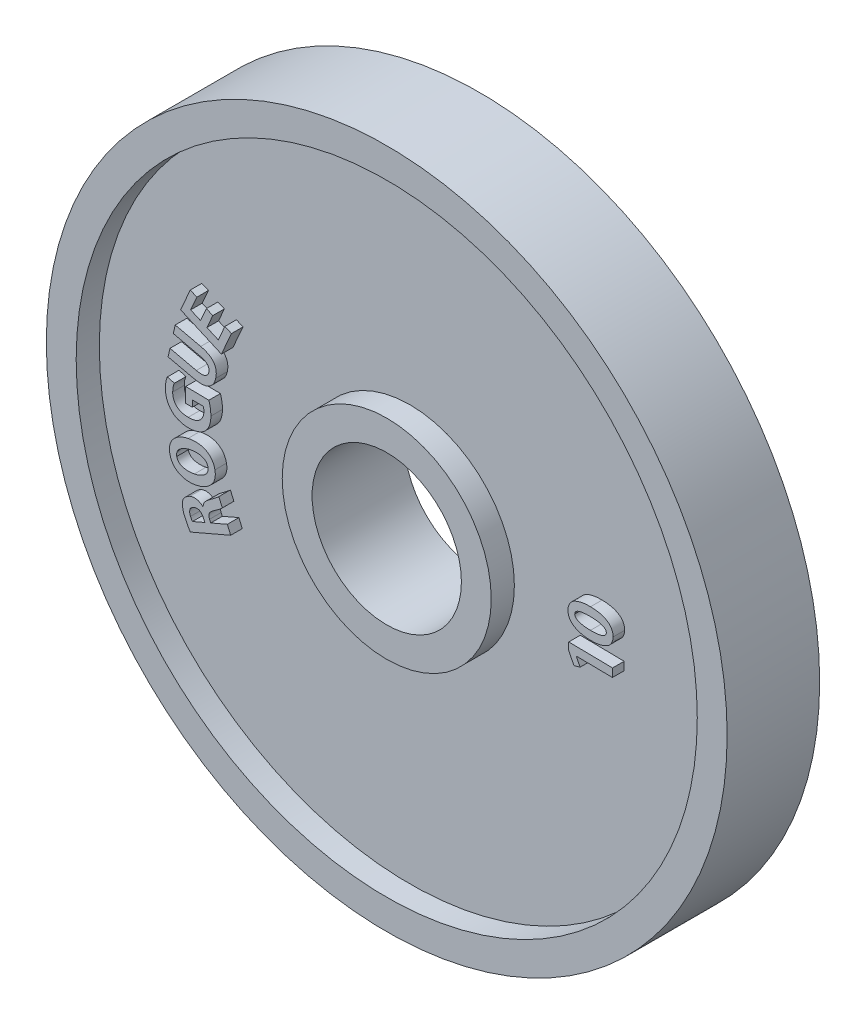
from build123d import *

# Parameters (mm, degrees)
SKETCH1_R           = 114
SKETCH1_R_2         = 25
BOSS_EXTRUDE1_DEPTH = 15.494
SKETCH2_R           = 104
SKETCH2_R_2         = 35
CUT_EXTRUDE1_DEPTH  = 7.747
BOSS_EXTRUDE2_DEPTH = 3.8735
BOSS_EXTRUDE3_DEPTH = 3.8735


with BuildPart() as part:
    # Sketch1 → Boss-Extrude1 (new, symmetric)
    with BuildSketch(Plane.XY):
        Circle(SKETCH1_R)
        Circle(SKETCH1_R_2, mode=Mode.SUBTRACT)
    extrude(amount=BOSS_EXTRUDE1_DEPTH, both=True)

    # Sketch2 → Cut-Extrude1 (cut)
    with BuildSketch(Plane.XY.offset(15.494)):
        Circle(SKETCH2_R)
        Circle(SKETCH2_R_2, mode=Mode.SUBTRACT)
    cut_extrude1 = extrude(amount=-CUT_EXTRUDE1_DEPTH, mode=Mode.SUBTRACT)

    # Sketch3 → Boss-Extrude2 (add)
    # profile 1 of 5: a face of its own
    with BuildSketch(Plane.XY.offset(7.747)):
        Polygon((-60.286471184, 25.582132055), (-64.087560951, 27.25839268), (-62.121479564, 31.716680211), (-64.270693872, 32.664472433), (-66.236775259, 28.206184903), (-69.540526178, 29.663121707), (-67.456949887, 34.387840764), (-69.6594505, 35.359131967), (-72.902309839, 28.005621857), (-59.24325362, 21.982049798), (-55.875066383, 29.619753536), (-58.077566996, 30.591044739), align=None)
    # profile 2 of 5: a face of its own
    with BuildSketch(Plane.XY.offset(7.747)):
        with BuildLine():
            Line((-75.346816467, 19.897241959), (-66.547785694, 17.881515031))
            add(Edge.make_bspline(
                [(-66.547785694, 17.881515031), (-66.393512184, 17.843386183), (-66.094568138, 17.769501872), (-65.668729211, 17.637308629), (-65.27849277, 17.495206858), (-64.926919007, 17.337505331), (-64.611067758, 17.170555263), (-64.333897809, 16.989729925), (-64.091997129, 16.799801126), (-63.890631002, 16.592383232), (-63.724798443, 16.373750598), (-63.583581558, 16.149036188), (-63.481141954, 15.91150908), (-63.404764195, 15.667002332), (-63.36794847, 15.411314117), (-63.355086408, 15.147557795), (-63.378658591, 14.873955514), (-63.417145205, 14.692346183), (-63.436918469, 14.599040772)],
                knots=[0, 0, 0, 0, 1.48875779, 2.884845742, 4.175826487, 5.37772822, 6.492655506, 7.519728366, 8.474900886, 9.368474524, 10.21968269, 11.042885758, 11.848312276, 12.63668492, 13.435921479, 14.261506249, 15.106814207, 16, 16, 16, 16], degree=3))
            add(Edge.make_bspline(
                [(-63.436918469, 14.599040772), (-63.45916645, 14.51035801), (-63.502806259, 14.336405198), (-63.602610084, 14.091752292), (-63.72394754, 13.866699535), (-63.871128536, 13.661624907), (-64.047037709, 13.479649027), (-64.244098251, 13.315357816), (-64.46701121, 13.173291722), (-64.714979915, 13.05312991), (-64.989232959, 12.953376035), (-65.291209982, 12.884436109), (-65.620563428, 12.84358389), (-65.976568542, 12.826802591), (-66.359481284, 12.840035657), (-66.769395212, 12.877022146), (-67.206594505, 12.94136874), (-67.505315637, 13.004430843), (-67.659524804, 13.036985468)],
                knots=[0, 0, 0, 0, 0.86400193, 1.694755128, 2.491561966, 3.278358146, 4.074130137, 4.879460264, 5.700234368, 6.567907229, 7.481446286, 8.454875503, 9.491061486, 10.617394065, 11.822722667, 13.112412442, 14.509337228, 16, 16, 16, 16], degree=3))
            Line((-67.659524804, 13.036985468), (-76.456550001, 15.053044372))
            Line((-76.456550001, 15.053044372), (-77.098114701, 12.252492642))
            Line((-77.098114701, 12.252492642), (-68.545078337, 10.293119371))
            add(Edge.make_bspline(
                [(-68.545078337, 10.293119371), (-68.287083188, 10.237575442), (-67.786999579, 10.129912144), (-67.05017072, 10.034403218), (-66.3559383, 9.983098329), (-65.704527146, 9.986784176), (-65.095410294, 10.046154035), (-64.528117011, 10.151861864), (-64.004655039, 10.319643829), (-63.522831932, 10.535819384), (-63.083930697, 10.805382874), (-62.685685054, 11.122168259), (-62.325558685, 11.484551249), (-62.006899488, 11.89544841), (-61.727829491, 12.352452023), (-61.493078964, 12.857820707), (-61.29069566, 13.40584366), (-61.195842468, 13.793475892), (-61.147215101, 13.992199143)],
                knots=[0, 0, 0, 0, 1.339526843, 2.59646517, 3.769042117, 4.872296921, 5.89953709, 6.873164299, 7.7965368, 8.683983356, 9.548468306, 10.404740217, 11.262173283, 12.13633444, 13.03913999, 13.975087544, 14.961909886, 16, 16, 16, 16], degree=3))
            add(Edge.make_bspline(
                [(-61.147215101, 13.992199143), (-61.104291173, 14.195725897), (-61.020735265, 14.591911972), (-60.958135198, 15.182805746), (-60.955655707, 15.75015863), (-61.00445691, 16.295588644), (-61.111703995, 16.818675894), (-61.274699861, 17.3187575), (-61.496468048, 17.794378719), (-61.772436477, 18.246430958), (-62.109243222, 18.67098421), (-62.509154354, 19.062006638), (-62.968173399, 19.424485296), (-63.490725734, 19.751237718), (-64.073294128, 20.050305826), (-64.717473053, 20.315208793), (-65.423109694, 20.548733996), (-65.917745105, 20.675171946), (-66.173324703, 20.740502813)],
                knots=[0, 0, 0, 0, 1.040329616, 2.02511021, 2.967003703, 3.875322497, 4.760327715, 5.633140889, 6.501097599, 7.380315193, 8.277542573, 9.205342804, 10.17283583, 11.198562336, 12.284173383, 13.445937183, 14.680308094, 16, 16, 16, 16], degree=3))
            Line((-66.173324703, 20.740502813), (-74.705251767, 22.697793689))
            Line((-74.705251767, 22.697793689), (-75.346816467, 19.897241959))
        make_face()
    # profile 3 of 5: a face of its own
    with BuildSketch(Plane.XY.offset(7.747)):
        with BuildLine():
            Line((-71.257173175, 1.728642416), (-68.986085169, 1.696863234))
            Line((-68.986085169, 1.696863234), (-68.955935689, 3.851485188))
            Line((-68.955935689, 3.851485188), (-65.306666073, 3.800421204))
            add(Edge.make_bspline(
                [(-65.306666073, 3.800421204), (-65.291474755, 3.76277559), (-65.25917644, 3.682737121), (-65.224883338, 3.548765811), (-65.190197834, 3.396418936), (-65.162000909, 3.221975114), (-65.144994587, 3.025646415), (-65.125925828, 2.809510907), (-65.11984809, 2.572276609), (-65.116399537, 2.407434246), (-65.11459723, 2.321283143)],
                knots=[0, 0, 0, 0, 0.648936774, 1.379706706, 2.208670299, 3.149786387, 4.204011777, 5.361402424, 6.620997133, 8, 8, 8, 8], degree=3))
            add(Edge.make_bspline(
                [(-65.11459723, 2.321283143), (-65.120968475, 2.16743663), (-65.133460108, 1.865801071), (-65.202774641, 1.425564758), (-65.307893959, 1.006679628), (-65.459374959, 0.611138197), (-65.646088515, 0.235173834), (-65.880559449, -0.114913988), (-66.15000171, -0.444861863), (-66.46115932, -0.749871623), (-66.811106727, -1.02547806), (-67.204479728, -1.262807838), (-67.635697698, -1.465178674), (-68.107549215, -1.630086907), (-68.618752039, -1.760236599), (-69.170097825, -1.846129773), (-69.760176985, -1.904805512), (-70.166773235, -1.911773069), (-70.376700799, -1.915370451)],
                knots=[0, 0, 0, 0, 0.968728953, 1.89931571, 2.800217423, 3.68281719, 4.560856096, 5.437349611, 6.329663634, 7.238555762, 8.175044564, 9.127561758, 10.124532544, 11.168795398, 12.269883655, 13.440786937, 14.678666205, 16, 16, 16, 16], degree=3))
            add(Edge.make_bspline(
                [(-70.376700799, -1.915370451), (-70.594230559, -1.905497325), (-71.015611734, -1.886371897), (-71.623727142, -1.805599545), (-72.188715711, -1.694032575), (-72.707403362, -1.535701627), (-73.182109473, -1.342270829), (-73.614170833, -1.112345354), (-73.998161901, -0.837946654), (-74.337025718, -0.526884256), (-74.632520826, -0.184892344), (-74.888501253, 0.180427123), (-75.104297844, 0.567927775), (-75.275694156, 0.978331185), (-75.40847265, 1.411166737), (-75.500552428, 1.866484306), (-75.551930157, 2.344413435), (-75.553645576, 2.669532297), (-75.554520809, 2.835412857)],
                knots=[0, 0, 0, 0, 1.311203904, 2.539958864, 3.691718909, 4.77676166, 5.801354197, 6.77568181, 7.718078945, 8.636445122, 9.540244502, 10.435463789, 11.319305436, 12.206758612, 13.109712463, 14.042400903, 15.001203341, 16, 16, 16, 16], degree=3))
            add(Edge.make_bspline(
                [(-75.554520809, 2.835412857), (-75.549342503, 2.992813475), (-75.539373976, 3.295818435), (-75.502984931, 3.730864702), (-75.450355735, 4.129552548), (-75.38028165, 4.492461973), (-75.295216168, 4.826327086), (-75.196200829, 5.131791536), (-75.094197017, 5.41798683), (-75.010892545, 5.594882018), (-74.970154796, 5.681387719)],
                knots=[0, 0, 0, 0, 1.290633007, 2.484540449, 3.576592985, 4.585178413, 5.512284822, 6.398318909, 7.216742151, 8, 8, 8, 8], degree=3))
            Line((-74.970154796, 5.681387719), (-77.32803676, 6.317827363))
            add(Edge.make_bspline(
                [(-77.32803676, 6.317827363), (-77.374445246, 6.219712107), (-77.47192755, 6.013618306), (-77.590345278, 5.672674533), (-77.699396222, 5.289887264), (-77.796876286, 4.865252421), (-77.877996691, 4.402089544), (-77.938409064, 3.905984643), (-77.98136481, 3.378297215), (-77.992836665, 3.016235652), (-77.998744037, 2.829793953)],
                knots=[0, 0, 0, 0, 0.72766899, 1.528488784, 2.41732343, 3.397227608, 4.449702492, 5.570233277, 6.748804397, 8, 8, 8, 8], degree=3))
            add(Edge.make_bspline(
                [(-77.998744037, 2.829793953), (-77.99554144, 2.560825971), (-77.989265428, 2.03373924), (-77.907133912, 1.259769981), (-77.761716486, 0.521492286), (-77.552728831, -0.180715681), (-77.286121922, -0.84938392), (-76.951307011, -1.479884492), (-76.560859974, -2.080059412), (-76.180055991, -2.543684449), (-75.851018638, -2.895621603), (-75.58307807, -3.139554661), (-75.307555274, -3.375259194), (-75.010216528, -3.586063775), (-74.704078943, -3.788595723), (-74.379678542, -3.969536048), (-74.042936722, -4.138990189), (-73.691096093, -4.29084603), (-73.324651131, -4.424501838), (-72.945265083, -4.548087928), (-72.548709904, -4.644846295), (-72.14060752, -4.738920795), (-71.715940865, -4.805919488), (-71.277700163, -4.863480313), (-70.824853221, -4.902161587), (-70.518165754, -4.916846991), (-70.362653539, -4.924293528)],
                knots=[0, 0, 0, 0, 1.577349294, 3.0910738, 4.558540398, 5.985643026, 7.383297865, 8.774231271, 10.166953729, 11.57669276, 12.287866084, 12.991530258, 13.701280405, 14.413386805, 15.128052883, 15.85378282, 16.590861035, 17.338933897, 18.100264297, 18.878648983, 19.678132549, 20.493910141, 21.334775367, 22.198831703, 23.086680412, 24, 24, 24, 24], degree=3))
            add(Edge.make_bspline(
                [(-70.362653539, -4.924293528), (-70.070207503, -4.921978516), (-69.497856134, -4.917447763), (-68.660907613, -4.823337826), (-67.863771652, -4.674720932), (-67.111209896, -4.455755419), (-66.409267187, -4.176008717), (-65.763156946, -3.840487289), (-65.176076578, -3.449864267), (-64.833861524, -3.139057872), (-64.665084912, -2.985771658)],
                knots=[0, 0, 0, 0, 1.136680665, 2.224618065, 3.270325393, 4.286883451, 5.267524713, 6.204201311, 7.114332304, 8, 8, 8, 8], degree=3))
            add(Edge.make_bspline(
                [(-64.665084912, -2.985771658), (-64.515064056, -2.827087286), (-64.214565499, -2.509235314), (-63.832864293, -1.969700587), (-63.50758448, -1.383513411), (-63.241015097, -0.749323618), (-63.03312519, -0.066574304), (-62.882808346, 0.662190216), (-62.78910238, 1.439543571), (-62.773777192, 1.97357981), (-62.765895369, 2.248237392)],
                knots=[0, 0, 0, 0, 0.915959266, 1.834707821, 2.765809318, 3.726141495, 4.717425164, 5.757718867, 6.84678329, 8, 8, 8, 8], degree=3))
            add(Edge.make_bspline(
                [(-62.765895369, 2.248237392), (-62.767572913, 2.460882861), (-62.770879305, 2.880001261), (-62.81142173, 3.49878559), (-62.877840194, 4.098987127), (-62.973825783, 4.67284669), (-63.083554403, 5.2088851), (-63.192789605, 5.69548548), (-63.3131575, 6.123711781), (-63.403482025, 6.386913561), (-63.44578275, 6.510176054)],
                knots=[0, 0, 0, 0, 1.176979382, 2.319794152, 3.431000493, 4.518493807, 5.539253432, 6.459768033, 7.278679526, 8, 8, 8, 8], degree=3))
            Line((-63.44578275, 6.510176054), (-71.188725706, 6.620216582))
            Line((-71.188725706, 6.620216582), (-71.257173175, 1.728642416))
        make_face()
    # profile 4 of 5: a face of its own
    with BuildSketch(Plane.XY.offset(7.747)):
        with BuildLine():
            add(Edge.make_bspline(
                [(-76.507706854, -15.564679114), (-76.448641989, -15.798915705), (-76.333360683, -16.256092738), (-76.082903922, -16.903333886), (-75.778953324, -17.498429094), (-75.416904551, -18.040617582), (-75.0025115, -18.533967328), (-74.528490507, -18.971897177), (-74.000764129, -19.358622746), (-73.420197439, -19.687774992), (-72.801012293, -19.966815858), (-72.146448415, -20.180898252), (-71.465449832, -20.343193222), (-70.754434659, -20.44316665), (-70.014888847, -20.484592113), (-69.24677376, -20.465806977), (-68.450268223, -20.39130005), (-67.914264284, -20.295665048), (-67.640442614, -20.246809183)],
                knots=[0, 0, 0, 0, 1.030942932, 2.012168244, 2.956667389, 3.879613322, 4.790670262, 5.701981774, 6.62916456, 7.578697646, 8.54726315, 9.524960566, 10.515475647, 11.533626462, 12.587250259, 13.675426278, 14.812473914, 16, 16, 16, 16], degree=3))
            add(Edge.make_bspline(
                [(-67.640442614, -20.246809183), (-67.376306876, -20.186884789), (-66.859337501, -20.069600106), (-66.116534621, -19.83389787), (-65.419583213, -19.561783701), (-64.767793804, -19.249808007), (-64.161835477, -18.896973933), (-63.605855819, -18.497912724), (-63.095245994, -18.061046939), (-62.630995234, -17.588262224), (-62.224327234, -17.078790901), (-61.89105933, -16.532502498), (-61.627588899, -15.958295377), (-61.434498775, -15.354907428), (-61.316735013, -14.7215635), (-61.274261707, -14.059103672), (-61.297910069, -13.367745718), (-61.369574231, -12.902380625), (-61.406268657, -12.664098273)],
                knots=[0, 0, 0, 0, 1.178993051, 2.307538178, 3.389691794, 4.434821654, 5.45106185, 6.438998567, 7.410778017, 8.373962956, 9.320374973, 10.242877386, 11.15344982, 12.065254194, 12.994644299, 13.951124069, 14.950907616, 16, 16, 16, 16], degree=3))
            add(Edge.make_bspline(
                [(-61.406268657, -12.664098273), (-61.459174207, -12.439110068), (-61.562620751, -11.999189261), (-61.786427521, -11.370550712), (-62.065310566, -10.790181365), (-62.39531613, -10.253257099), (-62.783272843, -9.765202147), (-63.223291984, -9.321107436), (-63.719705269, -8.92669859), (-64.264842502, -8.576650424), (-64.863164987, -8.284049677), (-65.510363751, -8.052789095), (-66.206864117, -7.888498157), (-66.950787894, -7.785239945), (-67.743242745, -7.747808534), (-68.582676148, -7.775364212), (-69.470568549, -7.865780418), (-70.073998733, -7.971274233), (-70.385277204, -8.025693044)],
                knots=[0, 0, 0, 0, 0.971616526, 1.899807702, 2.800097369, 3.675686937, 4.544944974, 5.416760719, 6.299542019, 7.206485548, 8.136638855, 9.094771387, 10.091261422, 11.141338146, 12.249588338, 13.423964941, 14.671156539, 16, 16, 16, 16], degree=3))
            add(Edge.make_bspline(
                [(-70.385277204, -8.025693044), (-70.631508984, -8.080316875), (-71.116105415, -8.187819299), (-71.816530934, -8.405501151), (-72.478811917, -8.664897135), (-73.104953024, -8.961443768), (-73.690985427, -9.303566229), (-74.241720147, -9.683394621), (-74.754480933, -10.105751967), (-75.148794596, -10.492466835), (-75.439969349, -10.819836461), (-75.641807089, -11.073601954), (-75.820873983, -11.338750252), (-75.984146068, -11.611639158), (-76.131721386, -11.893063716), (-76.257062682, -12.184676752), (-76.364190495, -12.484228906), (-76.454478128, -12.791855331), (-76.527711508, -13.108759422), (-76.58093184, -13.434436249), (-76.613888593, -13.768506563), (-76.631630402, -14.110760197), (-76.627377073, -14.462411908), (-76.608350986, -14.823439309), (-76.568846191, -15.192785915), (-76.529670676, -15.440923928), (-76.509882533, -15.566262174)],
                knots=[0, 0, 0, 0, 1.663556076, 3.273961384, 4.833286237, 6.353322139, 7.840155918, 9.305587846, 10.762842645, 12.217803286, 12.944384344, 13.652686548, 14.355333609, 15.053647759, 15.750073201, 16.450243702, 17.146011, 17.847924169, 18.564372358, 19.290664366, 20.023523602, 20.778248709, 21.550623865, 22.342692496, 23.162869027, 24, 24, 24, 24], degree=3))
            Line((-76.509882533, -15.566262174), (-76.507706854, -15.564679114))
        make_face()
        with BuildLine():
            add(Edge.make_bspline(
                [(-74.190830817, -15.168351588), (-74.208200397, -15.036186723), (-74.242078535, -14.778408488), (-74.227392573, -14.394396667), (-74.172086322, -14.026331987), (-74.054911042, -13.676923511), (-73.896207261, -13.341437725), (-73.676590515, -13.028800352), (-73.415442062, -12.728176984), (-73.100683934, -12.453912658), (-72.753959963, -12.194579993), (-72.380963063, -11.953865076), (-71.984964546, -11.733266084), (-71.565910061, -11.53476857), (-71.124656734, -11.354080861), (-70.658730267, -11.197690673), (-70.171526229, -11.058942845), (-69.836017782, -10.986852001), (-69.666057495, -10.950332562)],
                knots=[0, 0, 0, 0, 0.930930736, 1.815714643, 2.678395105, 3.525715937, 4.384207394, 5.265492005, 6.189287182, 7.163659837, 8.179077214, 9.216653281, 10.266544308, 11.34780991, 12.458502948, 13.599989841, 14.784214179, 16, 16, 16, 16], degree=3))
            add(Edge.make_bspline(
                [(-69.666057495, -10.950332562), (-69.480967718, -10.914601948), (-69.118713324, -10.844670632), (-68.580104801, -10.775889878), (-68.061741019, -10.732054072), (-67.561657468, -10.720460786), (-67.081069481, -10.739207466), (-66.619439858, -10.790357487), (-66.176760959, -10.867768253), (-65.756561373, -10.976810133), (-65.363812084, -11.113347754), (-65.00843316, -11.289535457), (-64.692301953, -11.496937637), (-64.414399652, -11.738404675), (-64.180869009, -12.0164963), (-63.984201092, -12.325453783), (-63.831271984, -12.669893844), (-63.762239877, -12.915000965), (-63.726875997, -13.040564839)],
                knots=[0, 0, 0, 0, 1.294378985, 2.533335351, 3.72712705, 4.865850014, 5.966612518, 7.027765508, 8.053494751, 9.050343993, 10.006502908, 10.903943613, 11.767342203, 12.596872572, 13.422879655, 14.252609478, 15.104843948, 16, 16, 16, 16], degree=3))
            add(Edge.make_bspline(
                [(-63.726875997, -13.040564839), (-63.709273245, -13.168595666), (-63.674678887, -13.420212252), (-63.684420149, -13.79598358), (-63.743680001, -14.157018898), (-63.852416045, -14.503588254), (-64.006984328, -14.837526984), (-64.21589737, -15.154859411), (-64.474061128, -15.456136611), (-64.778379669, -15.740787533), (-65.119427027, -16.008554677), (-65.493298864, -16.255021147), (-65.890762324, -16.487529889), (-66.321500188, -16.690247871), (-66.775230458, -16.879690828), (-67.258956506, -17.044867894), (-67.769944506, -17.1915645), (-68.123217203, -17.270602839), (-68.303473282, -17.310931858)],
                knots=[0, 0, 0, 0, 0.892961903, 1.754921301, 2.58895955, 3.416884956, 4.260407616, 5.126618111, 6.036716313, 6.999228421, 8.005078455, 9.032974195, 10.095413095, 11.18794985, 12.32381609, 13.495862028, 14.722272913, 16, 16, 16, 16], degree=3))
            add(Edge.make_bspline(
                [(-68.303473282, -17.310931858), (-68.474588646, -17.343317023), (-68.811896378, -17.407155632), (-69.315188057, -17.476023272), (-69.806889538, -17.510686799), (-70.286116036, -17.52458237), (-70.753476417, -17.504150061), (-71.208279666, -17.45593425), (-71.651926637, -17.384378948), (-72.078361594, -17.280747787), (-72.482915948, -17.151900998), (-72.848060236, -16.974013469), (-73.177376516, -16.76759421), (-73.464760688, -16.52074828), (-73.708502731, -16.234997358), (-73.915423969, -15.91573321), (-74.080298239, -15.557722124), (-74.154208597, -15.3014556), (-74.192084645, -15.170129444)],
                knots=[0, 0, 0, 0, 1.202398014, 2.370202993, 3.504903811, 4.60445999, 5.678801092, 6.732075408, 7.761093576, 8.778938089, 9.760436391, 10.685914818, 11.575620908, 12.437590667, 13.290441376, 14.160329912, 15.057244007, 16, 16, 16, 16], degree=3))
            Line((-74.192084645, -15.170129444), (-74.190830817, -15.168351588))
        make_face(mode=Mode.SUBTRACT)
    # profile 5 of 5: a face of its own
    with BuildSketch(Plane.XY.offset(7.747)):
        with BuildLine():
            Line((-56.123841132, -29.003529012), (-57.252705827, -26.38241731))
            Line((-57.252705827, -26.38241731), (-62.815881685, -28.77837503))
            Line((-62.815881685, -28.77837503), (-63.199849268, -27.886840438))
            add(Edge.make_bspline(
                [(-63.199849268, -27.886840438), (-63.232506654, -27.81292103), (-63.296183322, -27.668790032), (-63.365310518, -27.449546152), (-63.414913914, -27.236444023), (-63.440158828, -27.029227601), (-63.443554325, -26.827611755), (-63.423930511, -26.632364438), (-63.381393919, -26.442837458), (-63.316295025, -26.257507418), (-63.223064911, -26.074628389), (-63.105639779, -25.889347159), (-62.956135087, -25.703619579), (-62.783330563, -25.512248159), (-62.577907518, -25.322905079), (-62.351659851, -25.123784402), (-62.091132988, -24.929612723), (-61.907839641, -24.800165921), (-61.812967685, -24.733164737)],
                knots=[0, 0, 0, 0, 1.007759831, 1.96497016, 2.863679263, 3.734840772, 4.564653136, 5.375149402, 6.177516792, 6.98328118, 7.81948753, 8.733714842, 9.715645525, 10.791042734, 11.948403375, 13.199496786, 14.550469924, 16, 16, 16, 16], degree=3))
            add(Edge.make_bspline(
                [(-61.812967685, -24.733164737), (-61.628919631, -24.606508141), (-61.276803969, -24.364192232), (-60.779149055, -24.005209781), (-60.328722091, -23.676348541), (-59.934596721, -23.36842465), (-59.598212578, -23.091842848), (-59.317851192, -22.857529756), (-59.102188135, -22.659446765), (-58.986049436, -22.533964323), (-58.936088851, -22.479984244)],
                knots=[0, 0, 0, 0, 1.464981687, 2.802762577, 4.023608106, 5.121795089, 6.081855677, 6.879153201, 7.517833745, 8, 8, 8, 8], degree=3))
            Line((-58.936088851, -22.479984244), (-60.101745296, -19.767230633))
            add(Edge.make_bspline(
                [(-60.101745296, -19.767230633), (-60.132397983, -19.801805134), (-60.198201349, -19.876027617), (-60.31111646, -19.987880633), (-60.444147512, -20.108685734), (-60.595885608, -20.239658808), (-60.763776856, -20.383982027), (-60.953345374, -20.535071776), (-61.159931576, -20.697588262), (-61.46610392, -20.929656687), (-61.870063941, -21.234494551), (-62.373414567, -21.615663821), (-62.902312267, -22.007710596), (-63.261774455, -22.275742486), (-63.445259289, -22.412557397)],
                knots=[0, 0, 0, 0, 0.389646655, 0.836470264, 1.33964305, 1.905111083, 2.52711338, 3.206823372, 3.949478622, 4.744123037, 6.447116062, 8.218033387, 10.069522913, 12, 12, 12, 12], degree=3))
            add(Edge.make_bspline(
                [(-63.445259289, -22.412557397), (-63.595113359, -22.525418432), (-63.884316772, -22.743228976), (-64.272168771, -23.095948537), (-64.608025088, -23.450378561), (-64.886472798, -23.812834049), (-65.104455967, -24.187732416), (-65.258849467, -24.57517668), (-65.34662087, -24.979207556), (-65.352643623, -25.252496403), (-65.355686639, -25.390576502)],
                knots=[0, 0, 0, 0, 1.220923677, 2.35626095, 3.408858539, 4.396677885, 5.325426612, 6.223338976, 7.102336112, 8, 8, 8, 8], degree=3))
            Line((-65.355686639, -25.390576502), (-65.406761598, -25.412953348))
            add(Edge.make_bspline(
                [(-65.406761598, -25.412953348), (-65.546301373, -25.282176957), (-65.823650588, -25.02224584), (-66.303215707, -24.710282283), (-66.823293098, -24.46255843), (-67.28820625, -24.316261575), (-67.676300641, -24.237921838), (-67.973948828, -24.199545745), (-68.27575284, -24.193598419), (-68.58034857, -24.205550968), (-68.888392668, -24.249475101), (-69.199501408, -24.318009342), (-69.51632732, -24.405886095), (-69.723147841, -24.486881487), (-69.828334201, -24.528074742)],
                knots=[0, 0, 0, 0, 1.433935037, 2.850088867, 4.275173555, 5.74991224, 6.496108575, 7.247194154, 8.000022889, 8.760402491, 9.534226346, 10.332930841, 11.152149237, 12, 12, 12, 12], degree=3))
            add(Edge.make_bspline(
                [(-69.828334201, -24.528074742), (-69.932914801, -24.582189348), (-70.138226155, -24.688426479), (-70.428378101, -24.863373814), (-70.700831843, -25.040146522), (-70.950356087, -25.22507486), (-71.178672696, -25.417086237), (-71.387454565, -25.612767851), (-71.573134173, -25.816534522), (-71.741086453, -26.023980135), (-71.883495036, -26.241656167), (-72.008615129, -26.463222021), (-72.109592477, -26.692366613), (-72.191370036, -26.926257164), (-72.254430029, -27.166483745), (-72.29314053, -27.413068957), (-72.309925993, -27.665986401), (-72.303678414, -28.00674754), (-72.270061888, -28.427579732), (-72.215615641, -28.918922213), (-72.139776093, -29.388688616), (-72.04461121, -29.837050501), (-71.928487488, -30.264159052), (-71.798473278, -30.672595758), (-71.643775095, -31.059173959), (-71.523051809, -31.304252631), (-71.463435257, -31.425279368)],
                knots=[0, 0, 0, 0, 1.046935917, 2.055331782, 3.011653762, 3.934459313, 4.815268965, 5.663626756, 6.477090606, 7.265306808, 8.034505587, 8.787620192, 9.525851479, 10.2580921, 10.98933741, 11.731457728, 12.474372082, 13.240634546, 14.760273915, 16.227239636, 17.636151124, 18.99031167, 20.301480246, 21.570960831, 22.800472186, 24, 24, 24, 24], degree=3))
            add(Edge.make_bspline(
                [(-71.463435257, -31.425279368), (-71.317395666, -31.752520753), (-71.032231742, -32.391508011), (-70.641019399, -33.158938199), (-70.326643959, -33.732670245), (-70.097686377, -34.125658824), (-69.880760876, -34.491992914), (-69.731665381, -34.722154053), (-69.659767082, -34.833144626)],
                knots=[0, 0, 0, 0, 1.670823791, 3.262530846, 4.01499785, 4.721330908, 5.383387583, 6, 6, 6, 6], degree=3))
            Line((-69.659767082, -34.833144626), (-56.123841132, -29.003529012))
        make_face()
        with BuildLine():
            add(Edge.make_bspline(
                [(-68.949639682, -31.420072004), (-68.995800991, -31.361918753), (-69.102856618, -31.227051853), (-69.247138531, -30.968045312), (-69.411714387, -30.637610573), (-69.521354351, -30.389140921), (-69.581102426, -30.253737889)],
                knots=[0, 0, 0, 0, 0.668800342, 1.551057372, 2.665453696, 4, 4, 4, 4], degree=3))
            add(Edge.make_bspline(
                [(-69.581102426, -30.253737889), (-69.637032613, -30.126028604), (-69.749317148, -29.86964152), (-69.837979302, -29.455221712), (-69.871247764, -29.02462766), (-69.853746215, -28.657175692), (-69.798474224, -28.360430176), (-69.714446857, -28.144431156), (-69.59548349, -27.937638409), (-69.437571109, -27.742366548), (-69.245526017, -27.557268172), (-69.017302483, -27.381632135), (-68.752898931, -27.21696591), (-68.560196987, -27.118796542), (-68.460131084, -27.067819337)],
                knots=[0, 0, 0, 0, 1.301016883, 2.611900329, 3.93848702, 5.333195219, 6.039103113, 6.751500261, 7.489075935, 8.261843357, 9.091751017, 9.978144165, 10.950094504, 12, 12, 12, 12], degree=3))
            add(Edge.make_bspline(
                [(-68.460131084, -27.067819337), (-68.378248968, -27.035411781), (-68.21857778, -26.972216625), (-67.974839475, -26.904489409), (-67.735902998, -26.861917549), (-67.500430317, -26.844182927), (-67.269900978, -26.853738324), (-67.042186553, -26.882878025), (-66.820716729, -26.944094331), (-66.603224889, -27.024444244), (-66.394195082, -27.132468222), (-66.196011215, -27.264134461), (-66.007912634, -27.418529935), (-65.829983988, -27.594824697), (-65.669373744, -27.799926115), (-65.511880312, -28.02139598), (-65.372909114, -28.270824804), (-65.289143178, -28.446783882), (-65.246118012, -28.537162726)],
                knots=[0, 0, 0, 0, 1.0596079, 2.066249137, 3.039375434, 3.977587386, 4.902701654, 5.813135035, 6.734738943, 7.66239163, 8.600264816, 9.560240153, 10.521670901, 11.526163218, 12.568536639, 13.653805195, 14.794910849, 16, 16, 16, 16], degree=3))
            Line((-65.246118012, -28.537162726), (-64.777257788, -29.623103714))
            Line((-64.777257788, -29.623103714), (-68.949639682, -31.420072004))
        make_face(mode=Mode.SUBTRACT)
    extrude(amount=BOSS_EXTRUDE2_DEPTH)

    # Sketch4 → Boss-Extrude3 (add)
    # profile 1 of 2: a face of its own
    with BuildSketch(Plane.XY.offset(7.747)):
        with BuildLine():
            add(Edge.make_bspline(
                [(71.933559563, 5.529149663), (71.928287438, 5.718659991), (71.917992085, 6.088733811), (71.825275627, 6.626296127), (71.677118139, 7.133427819), (71.462339436, 7.606553732), (71.185661476, 8.048842307), (70.846188645, 8.456467665), (70.446470611, 8.833184056), (69.98513712, 9.171702384), (69.469596493, 9.479621914), (68.896411082, 9.743471254), (68.27290494, 9.976494252), (67.593915349, 10.160810027), (66.863963386, 10.312288062), (66.080868661, 10.427673894), (65.243905721, 10.499081723), (64.667825973, 10.517533709), (64.371765901, 10.527016591)],
                knots=[0, 0, 0, 0, 0.894573912, 1.746914728, 2.568497622, 3.384188044, 4.193060548, 5.025669035, 5.883114488, 6.781136974, 7.723395973, 8.71487786, 9.757643142, 10.864187891, 12.034564457, 13.277656321, 14.600927616, 16, 16, 16, 16], degree=3))
            add(Edge.make_bspline(
                [(64.371765901, 10.527016591), (64.115118504, 10.530019735), (63.611778294, 10.535909539), (62.87200665, 10.493585572), (62.162849489, 10.422457825), (61.483933321, 10.3143208), (60.837201297, 10.163867318), (60.220414417, 9.983478419), (59.636133359, 9.762023636), (59.083952937, 9.51108064), (58.576493542, 9.21695621), (58.130854903, 8.870883063), (57.745790771, 8.480921666), (57.429437095, 8.039880649), (57.172819117, 7.554668042), (56.986869124, 7.021084185), (56.856963485, 6.443999553), (56.826958503, 6.041954453), (56.811530607, 5.835231775)],
                knots=[0, 0, 0, 0, 1.234112295, 2.420357068, 3.561405222, 4.661004721, 5.724086801, 6.753005646, 7.749339845, 8.726731128, 9.667594546, 10.563132513, 11.432649331, 12.293961649, 13.164317972, 14.063247455, 15.004164775, 16, 16, 16, 16], degree=3))
            add(Edge.make_bspline(
                [(56.811530607, 5.835231775), (56.818771494, 5.634381929), (56.832875667, 5.243156228), (56.935962748, 4.676511387), (57.102609249, 4.148990809), (57.331174504, 3.657413385), (57.626978904, 3.204934145), (57.983686731, 2.788119261), (58.406824038, 2.412230374), (58.893035026, 2.080352838), (59.428502922, 1.784834122), (60.008623515, 1.525407089), (60.629670081, 1.304488864), (61.293463225, 1.121352245), (61.998922667, 0.980272083), (62.746460228, 0.874157859), (63.535109175, 0.802535633), (64.075682316, 0.788304579), (64.352099737, 0.781027652)],
                knots=[0, 0, 0, 0, 0.947626925, 1.84583665, 2.708328742, 3.552655769, 4.396126233, 5.251887286, 6.134673978, 7.059133649, 8.024651539, 9.017818227, 10.055176106, 11.132880588, 12.264974095, 13.448259293, 14.695189363, 16, 16, 16, 16], degree=3))
            add(Edge.make_bspline(
                [(64.352099737, 0.781027652), (64.609697404, 0.778953203), (65.11592125, 0.774876552), (65.85937884, 0.820187934), (66.571722978, 0.892887055), (67.252194342, 1.008314237), (67.900034158, 1.163381198), (68.519003733, 1.349873547), (69.104072066, 1.579347524), (69.657391789, 1.838869247), (70.163985999, 2.142938691), (70.612947428, 2.492299572), (70.996973426, 2.888978966), (71.313540574, 3.332207027), (71.570134496, 3.817265224), (71.756750251, 4.348677929), (71.886554199, 4.923025908), (71.916567641, 5.32321547), (71.932001195, 5.529001508)],
                knots=[0, 0, 0, 0, 1.234226161, 2.425467295, 3.567395557, 4.664560049, 5.730284245, 6.758139425, 7.759943597, 8.739586617, 9.684012525, 10.5854324, 11.458300558, 12.320196108, 13.187461777, 14.078972798, 15.012166699, 16, 16, 16, 16], degree=3))
            Line((71.932001195, 5.529001508), (71.933559563, 5.529149663))
        make_face()
        with BuildLine():
            add(Edge.make_bspline(
                [(69.662743175, 5.580339854), (69.656182672, 5.50089464), (69.643219036, 5.343909887), (69.569865727, 5.117433192), (69.455495527, 4.908657703), (69.304228313, 4.713457989), (69.108479653, 4.538772632), (68.873967947, 4.379049245), (68.599119311, 4.236228301), (68.284287526, 4.110476149), (67.929875382, 3.999515574), (67.536006143, 3.901323574), (67.10159129, 3.820434242), (66.625981464, 3.757589794), (66.110677004, 3.70670417), (65.554890119, 3.674808429), (64.959105515, 3.65385082), (64.547844617, 3.654672345), (64.335243025, 3.655097034)],
                knots=[0, 0, 0, 0, 0.621592284, 1.228274256, 1.844164184, 2.475399454, 3.149150752, 3.886350764, 4.68873187, 5.565681407, 6.53358078, 7.5901591, 8.737511544, 9.986277501, 11.339892691, 12.784931948, 14.337968459, 16, 16, 16, 16], degree=3))
            add(Edge.make_bspline(
                [(64.335243025, 3.655097034), (64.123539466, 3.660233306), (63.712969075, 3.670194412), (63.118133298, 3.707885251), (62.56319464, 3.756838786), (62.049426879, 3.823576497), (61.575755181, 3.907091085), (61.143513082, 4.007909096), (60.750568072, 4.121895385), (60.399073547, 4.253038496), (60.089141533, 4.399026802), (59.818885876, 4.555054165), (59.592283724, 4.727807641), (59.403905635, 4.91003122), (59.257461601, 5.105957668), (59.154121255, 5.314212211), (59.092378217, 5.535787704), (59.085207932, 5.68781577), (59.081567812, 5.764995475)],
                knots=[0, 0, 0, 0, 1.657488215, 3.214473983, 4.664598717, 6.017568152, 7.268573884, 8.427906352, 9.490247775, 10.469192498, 11.361107209, 12.169492556, 12.906964497, 13.586016039, 14.214988593, 14.811648327, 15.396712501, 16, 16, 16, 16], degree=3))
            add(Edge.make_bspline(
                [(59.081567812, 5.764995475), (59.089003397, 5.846929977), (59.103626776, 6.008068503), (59.175230487, 6.241079842), (59.293975278, 6.453397675), (59.450146242, 6.651619749), (59.654331358, 6.824455279), (59.896267685, 6.983905884), (60.181592721, 7.121839772), (60.506852033, 7.24563277), (60.870992196, 7.350194953), (61.271010701, 7.438772622), (61.704843599, 7.515396885), (62.174827927, 7.572364938), (62.679777915, 7.618015776), (63.219624843, 7.644097811), (63.793876062, 7.659621907), (64.18820692, 7.655217233), (64.391432065, 7.65294721)],
                knots=[0, 0, 0, 0, 0.644279807, 1.267088918, 1.895076685, 2.543365532, 3.235897883, 3.983743904, 4.81174385, 5.716382782, 6.711463638, 7.780903412, 8.929602751, 10.166218114, 11.493896374, 12.906436621, 14.405679261, 16, 16, 16, 16], degree=3))
            add(Edge.make_bspline(
                [(64.391432065, 7.65294721), (64.600294798, 7.648342952), (65.005107827, 7.639419084), (65.593678341, 7.609797081), (66.143264912, 7.560098512), (66.655880111, 7.505413805), (67.127442184, 7.423953024), (67.561696349, 7.337296525), (67.956285819, 7.229572718), (68.312659707, 7.110591793), (68.6300355, 6.977325251), (68.904337813, 6.824538946), (69.139758257, 6.660727794), (69.332442533, 6.478867023), (69.481074011, 6.280176966), (69.586905459, 6.066108275), (69.651793278, 5.837129116), (69.65854276, 5.679259833), (69.661963991, 5.599237808)],
                knots=[0, 0, 0, 0, 1.633157697, 3.165349337, 4.60563837, 5.946887471, 7.193768482, 8.345273847, 9.407287902, 10.388893002, 11.28096539, 12.093720263, 12.839233736, 13.517556305, 14.155947917, 14.768198112, 15.375614561, 16, 16, 16, 16], degree=3))
            Line((69.661963991, 5.599237808), (69.662743175, 5.580339854))
        make_face(mode=Mode.SUBTRACT)
    # profile 2 of 2: a face of its own
    with BuildSketch(Plane.XY.offset(7.747)):
        Polygon((57.074378984, -3.333447705), (57.040698484, -5.74041277), (58.815355774, -9.337570344), (60.881614428, -8.745209465), (59.596976045, -6.203308395), (59.597519279, -6.164486378), (71.709988642, -6.333975349), (71.749101481, -3.538790111), align=None)
    extrude(amount=BOSS_EXTRUDE3_DEPTH)

    # Mirror1: Cut-Extrude1 across plane
    add(cut_extrude1.mirror(Plane.XY), mode=Mode.SUBTRACT)


solid = part.part
